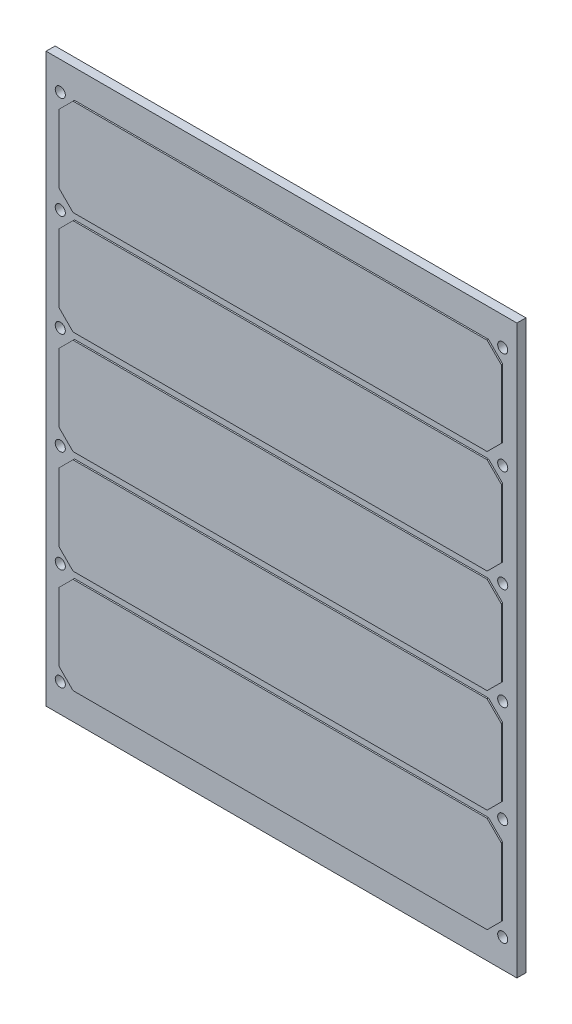
from build123d import *

# Parameters (mm, degrees)
SKETCH1_W                 = 83
SKETCH1_H                 = 100
BOSS_EXTRUDE1_DEPTH       = 1.5875
BOSS_EXTRUDE2_DEPTH       = 0.25
F_0_CLEARANCE_HOLE1_D     = 1.778
F_0_CLEARANCE_HOLE1_DEPTH = 3.175
F_0_CLEARANCE_HOLE1_TIP   = 0.53416509


with BuildPart() as part:
    # Sketch1 → Boss-Extrude1 (new body)
    with BuildSketch(Plane.XY):
        Rectangle(SKETCH1_W, SKETCH1_H)
    extrude(amount=BOSS_EXTRUDE1_DEPTH)

    # Sketch2 → Boss-Extrude2 (add)
    with BuildSketch(Plane.XY.offset(1.5875)):
        Polygon((-36.5, 45), (36.5, 45), (39, 42.5), (39, 30.5), (36.5, 28), (-36.5, 28), (-39, 30.5), (-39, 42.5), align=None)
        Polygon((-36.5, 26.75), (36.5, 26.75), (39, 24.25), (39, 12.25), (36.5, 9.75), (-36.5, 9.75), (-39, 12.25), (-39, 24.25), align=None)
        Polygon((-36.5, 8.5), (36.5, 8.5), (39, 6), (39, -6), (36.5, -8.5), (-36.5, -8.5), (-39, -6), (-39, 6), align=None)
        Polygon((-36.5, -9.75), (36.5, -9.75), (39, -12.25), (39, -24.25), (36.5, -26.75), (-36.5, -26.75), (-39, -24.25), (-39, -12.25), align=None)
        Polygon((-36.5, -28), (36.5, -28), (39, -30.5), (39, -42.5), (36.5, -45), (-36.5, -45), (-39, -42.5), (-39, -30.5), align=None)
    extrude(amount=BOSS_EXTRUDE2_DEPTH)

    # #0 Clearance Hole1
    with Locations(Plane.XY.offset(1.5875)):
        with Locations((-39, 45), (-39, 27), (-39, 9), (-39, -9), (-39, -27), (-39, -45), (39, -45), (39, -27), (39, -9), (39, 9), (39, 27), (39, 45)):
            Hole(F_0_CLEARANCE_HOLE1_D / 2, depth=F_0_CLEARANCE_HOLE1_DEPTH)
            with Locations((0, 0, -(F_0_CLEARANCE_HOLE1_DEPTH + F_0_CLEARANCE_HOLE1_TIP / 2))):  # 118° drill point
                Cone(0, F_0_CLEARANCE_HOLE1_D / 2, F_0_CLEARANCE_HOLE1_TIP, mode=Mode.SUBTRACT)


solid = part.part
